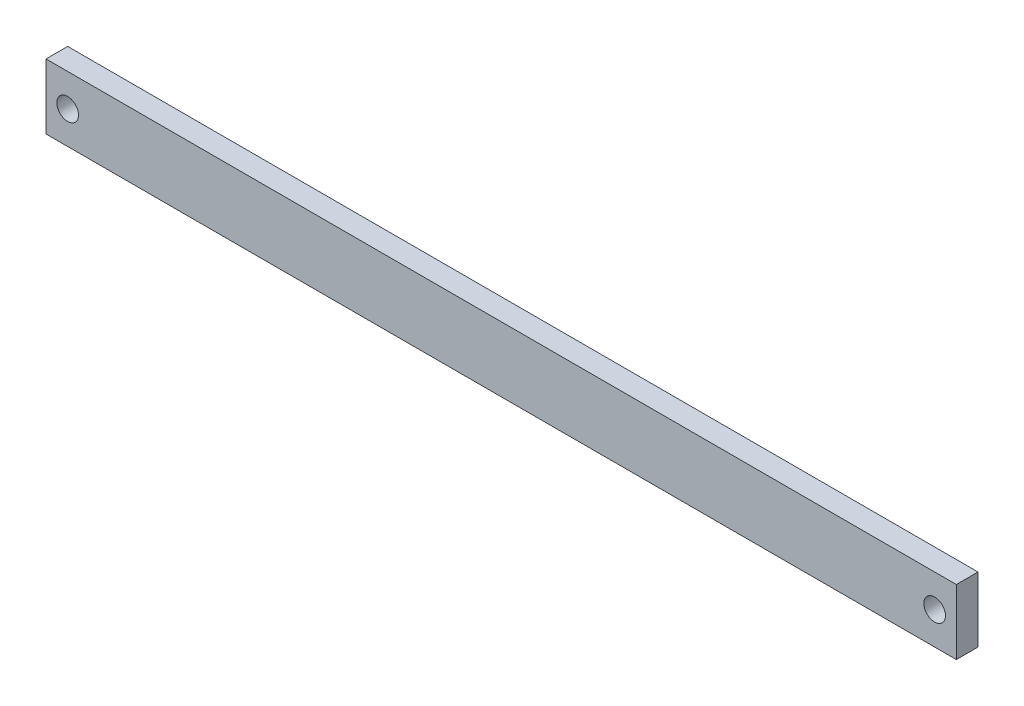
from build123d import *

# Parameters (mm, degrees)
SKETCH1_W           = 210
SKETCH1_H           = 15
SKETCH1_R           = 2.5
BOSS_EXTRUDE1_DEPTH = 5


with BuildPart() as part:
    # Sketch1 → Boss-Extrude1 (new body)
    with BuildSketch(Plane.XY):
        Rectangle(SKETCH1_W, SKETCH1_H)
        with Locations((100, 0)):
            Circle(SKETCH1_R, mode=Mode.SUBTRACT)
        with Locations((-100, 0)):
            Circle(SKETCH1_R, mode=Mode.SUBTRACT)
    extrude(amount=BOSS_EXTRUDE1_DEPTH)


solid = part.part
